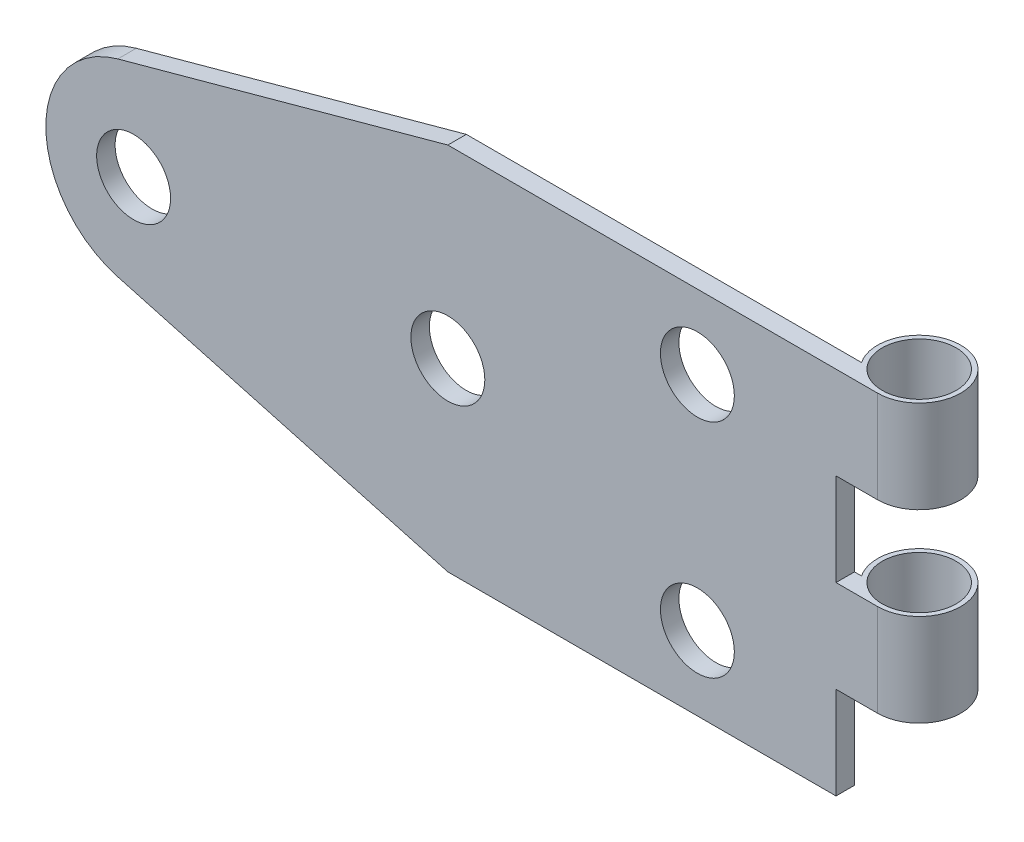
from build123d import *

# Parameters (mm, degrees)
BOSS_EXTRUDE1_DEPTH     = 2
SKETCH12_R              = 4.5
SKETCH12_R_2            = 4
BOSS_EXTRUDE12_DEPTH    = 20
CUT_EXTRUDE1_DEPTH      = 93.460802506
CUT_EXTRUDE1_DEPTH_BACK = 93.460802506
SKETCH3_R               = 4


with BuildPart() as part:
    # Sketch2 → Boss-Extrude1 (new body)
    with BuildSketch(Plane.XY):
        with BuildLine():
            Line((-4, 20), (-46.5, 20))
            Line((-46.5, 20), (-82.211080106, 10.211252251))
            ThreePointArc((-82.211080106, 10.211252251), (-90, 0), (-82.211080106, -10.211252251))
            Line((-82.211080106, -10.211252251), (-46.5, -20))
            Line((-46.5, -20), (-4, -20))
            Line((-4, -20), (-4, -10))
            Line((-4, -10), (-4, 0))
            Line((-4, 0), (-4, 10))
            Line((-4, 10), (-4, 20))
        make_face()
    extrude(amount=BOSS_EXTRUDE1_DEPTH)

    # Sketch12 → Boss-Extrude12 (add, symmetric)
    # profile 1 of 2: a face of its own
    with BuildSketch(Plane(origin=(0, 0, 0), x_dir=(1, 0, 0), z_dir=(0, 1, 0))):
        with Locations((0, 2.5)):
            Circle(SKETCH12_R)
        with Locations(Location((0, 2.5, 0), (0, 0, 270))):
            Circle(SKETCH12_R_2, mode=Mode.SUBTRACT)
    # profile 2 of 2: a face of its own
    with BuildSketch(Plane(origin=(0, 0, 0), x_dir=(1, 0, 0), z_dir=(0, 1, 0))):
        with BuildLine():
            Line((-4, 0), (-4, -2))
            Line((-4, -2), (0, -2))
            ThreePointArc((0, -2), (-2.121320344, -1.468626967), (-3.741657387, 0))
            Line((-3.741657387, 0), (-4, 0))
        make_face()
    extrude(amount=BOSS_EXTRUDE12_DEPTH, both=True)

    # Sketch3 → Cut-Extrude1 (cut, two sides: drawn at the far end of the back side and taken through both)
    with BuildSketch(Plane.XY.offset(-CUT_EXTRUDE1_DEPTH_BACK)):
        with Locations((-19.5, -12)):
            Circle(SKETCH3_R)
        with Locations((-19.5, 12)):
            Circle(SKETCH3_R)
        with Locations((-46.5, 0)):
            Circle(SKETCH3_R)
        with Locations((-80.5, 0)):
            Circle(SKETCH3_R)
        Polygon((0, 10), (4.5, 10), (4.5, 0), (-4.5, 0), (-4.5, 10), align=None)
        Polygon((0, -10), (4.5, -10), (4.5, -20), (0, -20), (-4.5, -20), (-4.5, -10), align=None)
    extrude(amount=CUT_EXTRUDE1_DEPTH + CUT_EXTRUDE1_DEPTH_BACK, mode=Mode.SUBTRACT)


solid = part.part
